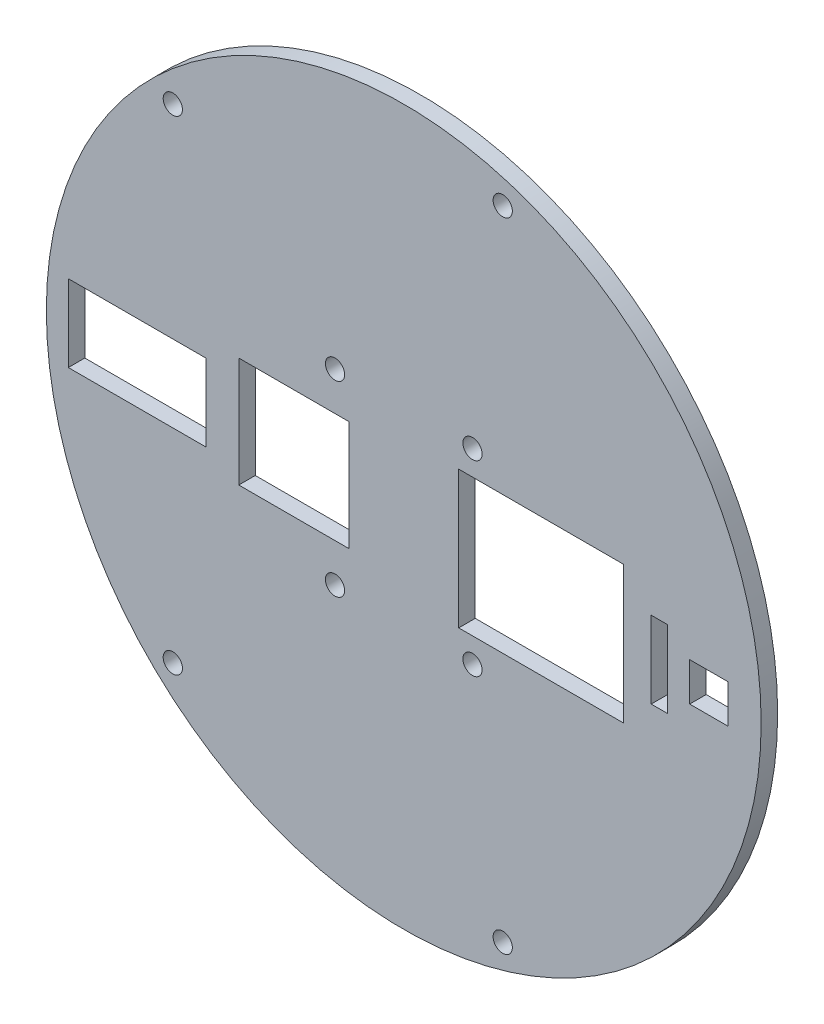
from build123d import *

# Parameters (mm, degrees)
CROQUIS1_R              = 65
CROQUIS1_R_2            = 1.75
CROQUIS1_W              = 20
CROQUIS1_H              = 20
CROQUIS1_W_2            = 25
CROQUIS1_H_2            = 14
CROQUIS1_W_3            = 30
CROQUIS1_H_3            = 25
CROQUIS1_W_4            = 3
CROQUIS1_W_5            = 7
CROQUIS1_H_4            = 7
SALIENTE_EXTRUIR1_DEPTH = 3
CROQUIS2_R              = 1.75
CORTAR_EXTRUIR1_DEPTH   = 3


with BuildPart() as part:
    # Croquis1 → Saliente-Extruir1 (new body)
    with BuildSketch(Plane.XY):
        Circle(CROQUIS1_R)
        with Locations((-12.5, 17)):
            Circle(CROQUIS1_R_2, mode=Mode.SUBTRACT)
        with Locations((12.5, 17)):
            Circle(CROQUIS1_R_2, mode=Mode.SUBTRACT)
        with Locations(Location((12.5, -17, 0), (0, 0, 180))):
            Circle(CROQUIS1_R_2, mode=Mode.SUBTRACT)
        with Locations(Location((-12.5, -17, 0), (0, 0, 180))):
            Circle(CROQUIS1_R_2, mode=Mode.SUBTRACT)
        with Locations((-20, 0)):
            Rectangle(CROQUIS1_W, CROQUIS1_H, mode=Mode.SUBTRACT)
        with Locations((-48.5, 0)):
            Rectangle(CROQUIS1_W_2, CROQUIS1_H_2, mode=Mode.SUBTRACT)
        with Locations((25, 0)):
            Rectangle(CROQUIS1_W_3, CROQUIS1_H_3, mode=Mode.SUBTRACT)
        with Locations((46.5, 0)):
            Rectangle(CROQUIS1_W_4, CROQUIS1_H_2, mode=Mode.SUBTRACT)
        with Locations((55.5, 0)):
            Rectangle(CROQUIS1_W_5, CROQUIS1_H_4, mode=Mode.SUBTRACT)
    extrude(amount=SALIENTE_EXTRUIR1_DEPTH)

    # Croquis2 → Cortar-Extruir1 (cut)
    with BuildSketch(Plane.XY.offset(3)):
        with Locations((-42, 44)):
            Circle(CROQUIS2_R)
        with Locations((18, 58)):
            Circle(CROQUIS2_R)
        with Locations(Location((18, -58, 0), (0, 0, 180))):
            Circle(CROQUIS2_R)
        with Locations(Location((-42, -44, 0), (0, 0, 180))):
            Circle(CROQUIS2_R)
    extrude(amount=-CORTAR_EXTRUIR1_DEPTH, mode=Mode.SUBTRACT)


solid = part.part
